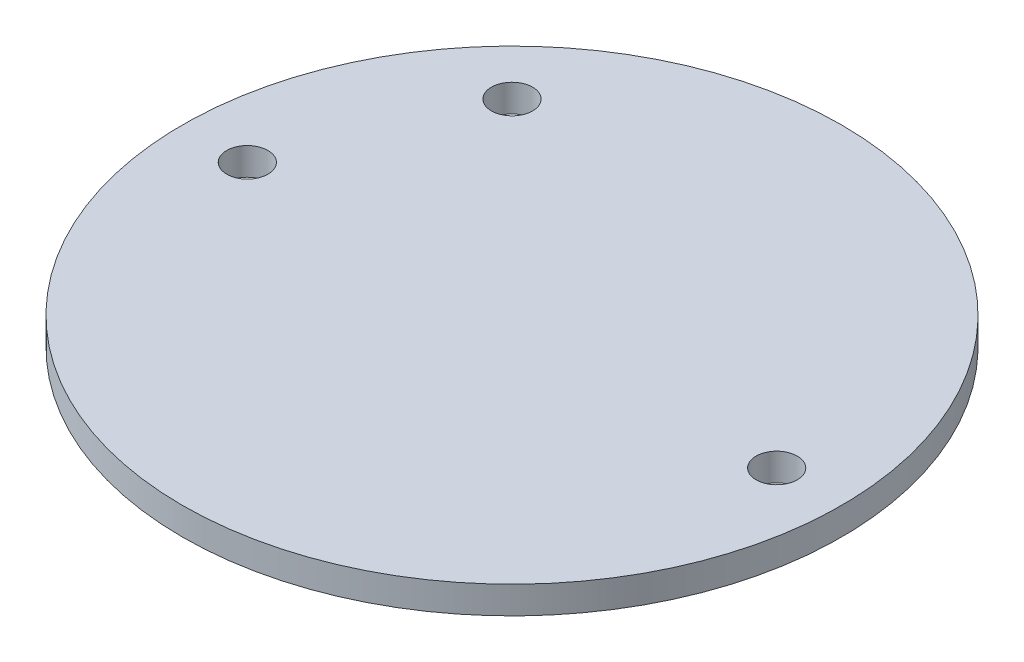
from build123d import *

# Parameters (mm, degrees)
SKETCH1_R           = 24
SKETCH1_R_2         = 1.5
BOSS_EXTRUDE1_DEPTH = 2


with BuildPart() as part:
    # Sketch1 → Boss-Extrude1 (new body)
    with BuildSketch(Plane(origin=(0, 0, 0), x_dir=(1, 0, 0), z_dir=(0, 1, 0))):
        with Locations(Location((0, 0, 0), (0, 0, 270))):
            Circle(SKETCH1_R)
        with Locations(Location((-19.275, 0, 0), (0, 0, 270))):
            Circle(SKETCH1_R_2, mode=Mode.SUBTRACT)
        with Locations(Location((19.275, 0, 0), (0, 0, 270))):
            Circle(SKETCH1_R_2, mode=Mode.SUBTRACT)
        with Locations(Location((-13.629483207, 13.629483207, 0), (0, 0, 270))):
            Circle(SKETCH1_R_2, mode=Mode.SUBTRACT)
    extrude(amount=BOSS_EXTRUDE1_DEPTH)


solid = part.part
